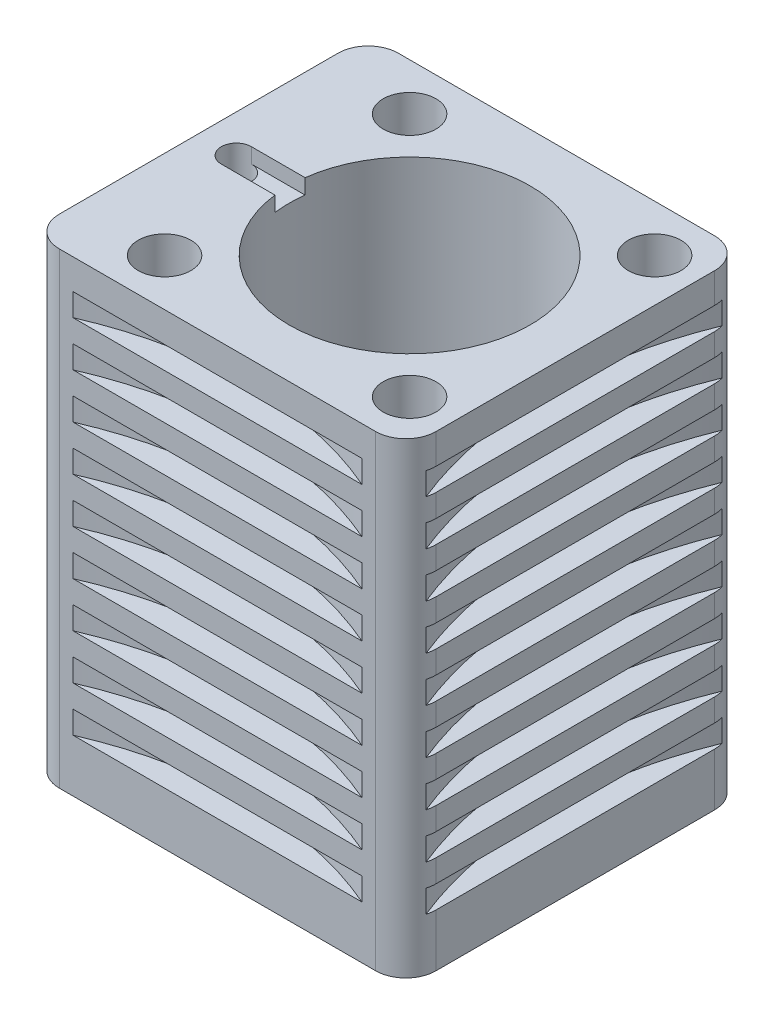
from build123d import *

# Parameters (mm, degrees)
BOSS_EXTRUDE1_DEPTH     = 62
SKETCH3_R               = 18
BOSS_EXTRUDE2_DEPTH     = 2
SKETCH4_R               = 16
CUT_EXTRUDE1_DEPTH      = 74.391075752
CUT_EXTRUDE2_DEPTH      = 2
SKETCH6_R               = 2
CUT_EXTRUDE3_DEPTH      = 72.653680994
SKETCH7_R               = 3.5
CUT_EXTRUDE4_DEPTH      = 74.391075752
SKETCH8_W               = 48
SKETCH8_H               = 3
LPATTERN1_COUNT         = 9
LPATTERN1_PITCH         = 6
MIRROR1_COPY_1_SKETCH_W = 48
MIRROR1_COPY_1_SKETCH_H = 3
MIRROR1_COPY_2_SKETCH_W = 48
MIRROR1_COPY_2_SKETCH_H = 3
MIRROR1_COPY_3_SKETCH_W = 48
MIRROR1_COPY_3_SKETCH_H = 3
MIRROR1_COPY_4_SKETCH_W = 48
MIRROR1_COPY_4_SKETCH_H = 3
MIRROR1_COPY_5_SKETCH_W = 48
MIRROR1_COPY_5_SKETCH_H = 3
MIRROR1_COPY_6_SKETCH_W = 48
MIRROR1_COPY_6_SKETCH_H = 3
MIRROR1_COPY_7_SKETCH_W = 48
MIRROR1_COPY_7_SKETCH_H = 3
MIRROR1_COPY_8_SKETCH_W = 48
MIRROR1_COPY_8_SKETCH_H = 3
SKETCH11_W              = 52.265084003
SKETCH11_H              = 3
LPATTERN2_COUNT         = 9
LPATTERN2_PITCH         = 6


with BuildPart() as part:
    # Sketch1 → Boss-Extrude1 (new body)
    with BuildSketch(Plane(origin=(0, 0, 0), x_dir=(1, 0, 0), z_dir=(0, 1, 0))):
        with BuildLine():
            Line((18, 22.5), (-24, 22.5))
            ThreePointArc((-24, 22.5), (-26.828427125, 21.328427125), (-28, 18.5))
            Line((-28, 18.5), (-28, -18.5))
            ThreePointArc((-28, -18.5), (-26.828427125, -21.328427125), (-24, -22.5))
            Line((-24, -22.5), (18, -22.5))
            ThreePointArc((18, -22.5), (20.828427125, -21.328427125), (22, -18.5))
            Line((22, -18.5), (22, 18.5))
            ThreePointArc((22, 18.5), (20.828427125, 21.328427125), (18, 22.5))
        make_face()
    extrude(amount=-BOSS_EXTRUDE1_DEPTH)

    # Sketch3 → Boss-Extrude2 (add)
    with BuildSketch(Plane.XZ.offset(62)):
        with Locations(Location((0, 0, 0), (0, 0, 270))):
            Circle(SKETCH3_R)
    extrude(amount=BOSS_EXTRUDE2_DEPTH)

    # Sketch4 → Cut-Extrude1 (cut, through all)
    with BuildSketch(Plane(origin=(0, 0, 0), x_dir=(1, 0, 0), z_dir=(0, 1, 0))):
        with Locations(Location((0, 0, 0), (0, 0, 270))):
            Circle(SKETCH4_R)
    extrude(amount=-CUT_EXTRUDE1_DEPTH, mode=Mode.SUBTRACT)

    # Sketch5 → Cut-Extrude2 (cut)
    with BuildSketch(Plane(origin=(0, 0, 0), x_dir=(1, 0, 0), z_dir=(0, 1, 0))):
        with BuildLine():
            Line((-23, 2), (-11, 2))
            ThreePointArc((-11, 2), (-9, 0), (-11, -2))
            Line((-11, -2), (-23, -2))
            ThreePointArc((-23, -2), (-25, 0), (-23, 2))
        make_face()
    extrude(amount=-CUT_EXTRUDE2_DEPTH, mode=Mode.SUBTRACT)

    # Sketch6 → Cut-Extrude3 (cut, through all)
    with BuildSketch(Plane(origin=(0, -2, 0), x_dir=(1, 0, 0), z_dir=(0, 1, 0))):
        with Locations(Location((-23, 0, 0), (0, 0, 270))):
            Circle(SKETCH6_R)
    extrude(amount=-CUT_EXTRUDE3_DEPTH, mode=Mode.SUBTRACT)

    # Sketch7 → Cut-Extrude4 (cut, through all)
    with BuildSketch(Plane(origin=(0, 0, 0), x_dir=(1, 0, 0), z_dir=(0, 1, 0))):
        with Locations(Location((16.263455967, 16.263455967, 0), (0, 0, 270))):
            Circle(SKETCH7_R)
        with Locations(Location((16.263455967, -16.263455967, 0), (0, 0, 270))):
            Circle(SKETCH7_R)
        with Locations(Location((-16.263455967, -16.263455967, 0), (0, 0, 270))):
            Circle(SKETCH7_R)
        with Locations(Location((-16.263455967, 16.263455967, 0), (0, 0, 270))):
            Circle(SKETCH7_R)
    extrude(amount=-CUT_EXTRUDE4_DEPTH, mode=Mode.SUBTRACT)

    # Sketch8 → Cut-Revolve1 (revolve, cut)
    with BuildSketch(Plane(origin=(-3, 0, 0), x_dir=(0, 0, -1), z_dir=(1, 0, 0))):
        with Locations((-42.5, -5.5)):
            Rectangle(SKETCH8_W, SKETCH8_H)
    cut_revolve1 = revolve(axis=Axis((-3, -4, 66.5), (0, -1, 0)), mode=Mode.SUBTRACT)

    # LPattern1: Cut-Revolve1 ×9
    with Locations(*[(0, -i * LPATTERN1_PITCH, 0) for i in range(1, LPATTERN1_COUNT)]):
        add(cut_revolve1, mode=Mode.SUBTRACT)

    # Mirror1: Cut-Revolve1 across plane
    add(cut_revolve1.mirror(Plane.XY), mode=Mode.SUBTRACT)

    # Mirror1 copy 1 sketch → Mirror1 copy 1 (revolve, cut)
    with BuildSketch(Plane(origin=(-3, -6, 0), x_dir=(0, 0, 1), z_dir=(1, 0, 0))):
        with Locations((-42.5, 5.5)):
            Rectangle(MIRROR1_COPY_1_SKETCH_W, MIRROR1_COPY_1_SKETCH_H)
    revolve(axis=Axis((-3, -10, -66.5), (0, 1, 0)), mode=Mode.SUBTRACT)

    # Mirror1 copy 2 sketch → Mirror1 copy 2 (revolve, cut)
    with BuildSketch(Plane(origin=(-3, -12, 0), x_dir=(0, 0, 1), z_dir=(1, 0, 0))):
        with Locations((-42.5, 5.5)):
            Rectangle(MIRROR1_COPY_2_SKETCH_W, MIRROR1_COPY_2_SKETCH_H)
    revolve(axis=Axis((-3, -16, -66.5), (0, 1, 0)), mode=Mode.SUBTRACT)

    # Mirror1 copy 3 sketch → Mirror1 copy 3 (revolve, cut)
    with BuildSketch(Plane(origin=(-3, -18, 0), x_dir=(0, 0, 1), z_dir=(1, 0, 0))):
        with Locations((-42.5, 5.5)):
            Rectangle(MIRROR1_COPY_3_SKETCH_W, MIRROR1_COPY_3_SKETCH_H)
    revolve(axis=Axis((-3, -22, -66.5), (0, 1, 0)), mode=Mode.SUBTRACT)

    # Mirror1 copy 4 sketch → Mirror1 copy 4 (revolve, cut)
    with BuildSketch(Plane(origin=(-3, -24, 0), x_dir=(0, 0, 1), z_dir=(1, 0, 0))):
        with Locations((-42.5, 5.5)):
            Rectangle(MIRROR1_COPY_4_SKETCH_W, MIRROR1_COPY_4_SKETCH_H)
    revolve(axis=Axis((-3, -28, -66.5), (0, 1, 0)), mode=Mode.SUBTRACT)

    # Mirror1 copy 5 sketch → Mirror1 copy 5 (revolve, cut)
    with BuildSketch(Plane(origin=(-3, -30, 0), x_dir=(0, 0, 1), z_dir=(1, 0, 0))):
        with Locations((-42.5, 5.5)):
            Rectangle(MIRROR1_COPY_5_SKETCH_W, MIRROR1_COPY_5_SKETCH_H)
    revolve(axis=Axis((-3, -34, -66.5), (0, 1, 0)), mode=Mode.SUBTRACT)

    # Mirror1 copy 6 sketch → Mirror1 copy 6 (revolve, cut)
    with BuildSketch(Plane(origin=(-3, -36, 0), x_dir=(0, 0, 1), z_dir=(1, 0, 0))):
        with Locations((-42.5, 5.5)):
            Rectangle(MIRROR1_COPY_6_SKETCH_W, MIRROR1_COPY_6_SKETCH_H)
    revolve(axis=Axis((-3, -40, -66.5), (0, 1, 0)), mode=Mode.SUBTRACT)

    # Mirror1 copy 7 sketch → Mirror1 copy 7 (revolve, cut)
    with BuildSketch(Plane(origin=(-3, -42, 0), x_dir=(0, 0, 1), z_dir=(1, 0, 0))):
        with Locations((-42.5, 5.5)):
            Rectangle(MIRROR1_COPY_7_SKETCH_W, MIRROR1_COPY_7_SKETCH_H)
    revolve(axis=Axis((-3, -46, -66.5), (0, 1, 0)), mode=Mode.SUBTRACT)

    # Mirror1 copy 8 sketch → Mirror1 copy 8 (revolve, cut)
    with BuildSketch(Plane(origin=(-3, -48, 0), x_dir=(0, 0, 1), z_dir=(1, 0, 0))):
        with Locations((-42.5, 5.5)):
            Rectangle(MIRROR1_COPY_8_SKETCH_W, MIRROR1_COPY_8_SKETCH_H)
    revolve(axis=Axis((-3, -52, -66.5), (0, 1, 0)), mode=Mode.SUBTRACT)

    # Sketch11 → Cut-Revolve3 (revolve, cut)
    with BuildSketch(Plane.XY):
        with Locations((44.132542001, -5.5)):
            Rectangle(SKETCH11_W, SKETCH11_H)
    cut_revolve3 = revolve(axis=Axis((70.265084003, -4, 0), (0, -1, 0)), mode=Mode.SUBTRACT)

    # LPattern2: Cut-Revolve3 ×9
    with Locations(*[(0, -i * LPATTERN2_PITCH, 0) for i in range(1, LPATTERN2_COUNT)]):
        add(cut_revolve3, mode=Mode.SUBTRACT)


solid = part.part
